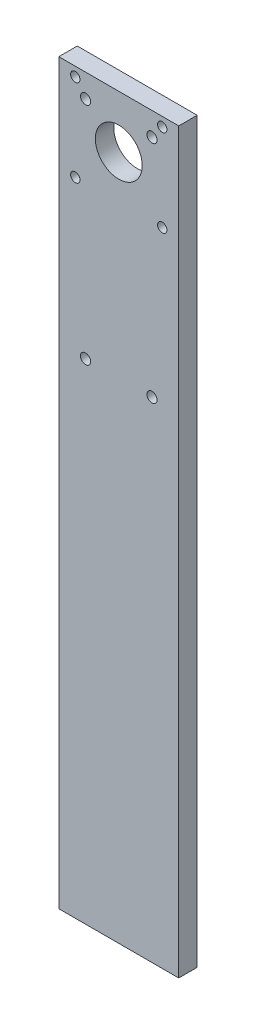
from build123d import *

# Parameters (mm, degrees)
SKETCH1_W           = 65
SKETCH1_H           = 400
SKETCH1_R           = 2.54
SKETCH1_R_2         = 12.7
SKETCH1_R_3         = 2.75
BOSS_EXTRUDE1_DEPTH = 10


with BuildPart() as part:
    # Sketch1 → Boss-Extrude1 (new body)
    with BuildSketch(Plane.XY):
        with Locations((0, -171.425)):
            Rectangle(SKETCH1_W, SKETCH1_H)
        with Locations((-23.5712, 23.5712)):
            Circle(SKETCH1_R, mode=Mode.SUBTRACT)
        with Locations((23.5712, 23.5712)):
            Circle(SKETCH1_R, mode=Mode.SUBTRACT)
        with Locations((23.5712, -23.5712)):
            Circle(SKETCH1_R, mode=Mode.SUBTRACT)
        with Locations((-23.5712, -23.5712)):
            Circle(SKETCH1_R, mode=Mode.SUBTRACT)
        Circle(SKETCH1_R_2, mode=Mode.SUBTRACT)
        with Locations((18, 16)):
            Circle(SKETCH1_R_3, mode=Mode.SUBTRACT)
        with Locations((-18, 16)):
            Circle(SKETCH1_R_3, mode=Mode.SUBTRACT)
        with Locations((18, -106)):
            Circle(SKETCH1_R_3, mode=Mode.SUBTRACT)
        with Locations((-18, -106)):
            Circle(SKETCH1_R_3, mode=Mode.SUBTRACT)
    extrude(amount=BOSS_EXTRUDE1_DEPTH)


solid = part.part
